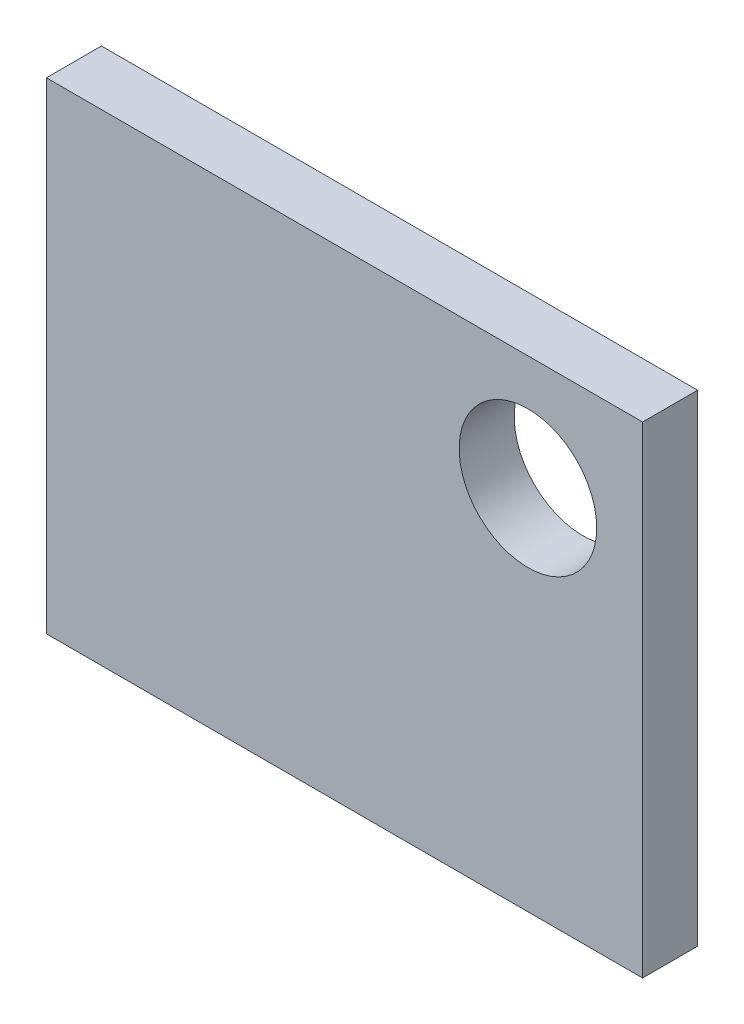
from build123d import *

# Parameters (mm, degrees)
SKIZZE1_W                       = 13
SKIZZE1_H                       = 10.5
AUFSATZ_LINEAR_AUSTRAGEN1_DEPTH = 1.2
SKIZZE2_R                       = 1.5
SCHNITT_LINEAR_AUSTRAGEN1_DEPTH = 1.2


with BuildPart() as part:
    # Skizze1 → Aufsatz-Linear austragen1 (new body)
    with BuildSketch(Plane.XY):
        with Locations((1.5, -0.25)):
            Rectangle(SKIZZE1_W, SKIZZE1_H)
    extrude(amount=AUFSATZ_LINEAR_AUSTRAGEN1_DEPTH)

    # Skizze2 → Schnitt-Linear austragen1 (cut)
    with BuildSketch(Plane.XY.offset(1.2)):
        with Locations((5.5, 2.5)):
            Circle(SKIZZE2_R)
    extrude(amount=-SCHNITT_LINEAR_AUSTRAGEN1_DEPTH, mode=Mode.SUBTRACT)


solid = part.part
